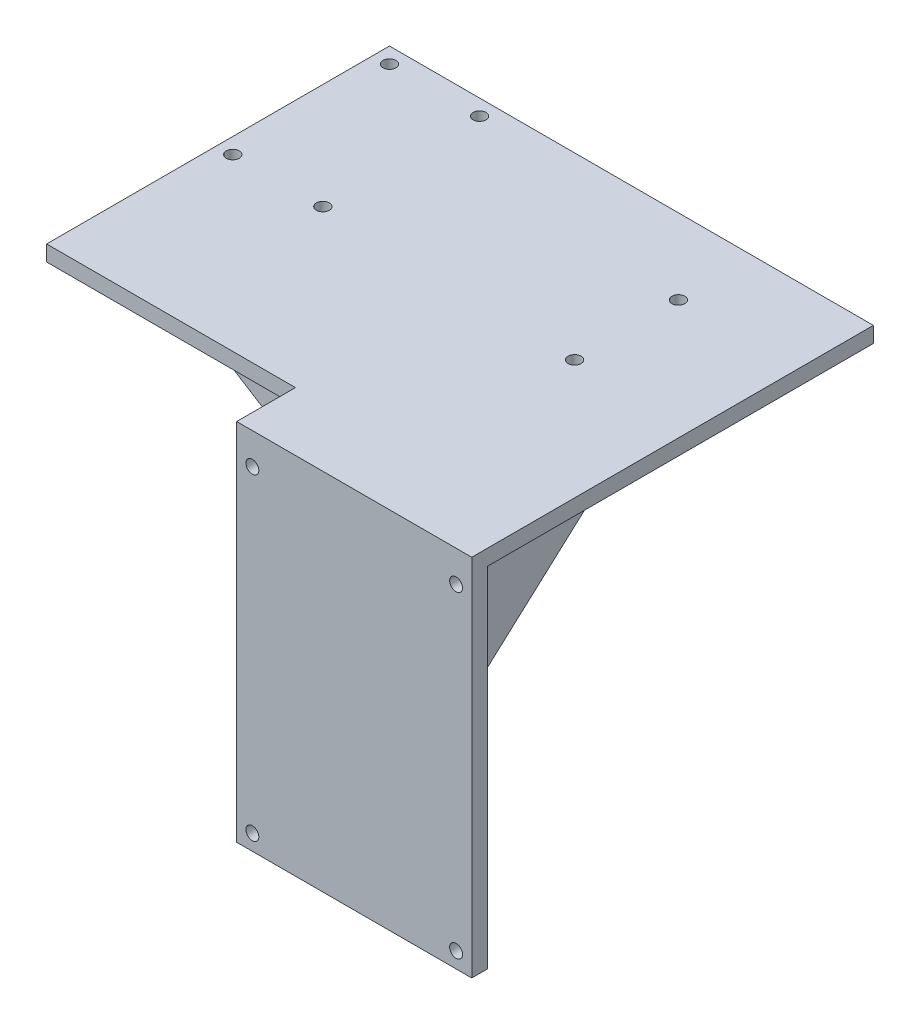
from build123d import *

# Parameters (mm, degrees)
SKETCH1_W           = 60
SKETCH1_H           = 93
BOSS_EXTRUDE1_DEPTH = 4
SKETCH3_R           = 1.65
CUT_EXTRUDE1_DEPTH  = 4
SKETCH5_W           = 60
SKETCH5_H           = 4
BOSS_EXTRUDE2_DEPTH = 11
SKETCH6_W           = 123.5
SKETCH6_H           = 4
BOSS_EXTRUDE3_DEPTH = 87.5
SKETCH7_R           = 1.65
CUT_EXTRUDE2_DEPTH  = 87.5
SKETCH10_R          = 1.65
CUT_EXTRUDE3_DEPTH  = 10
SKETCH11_W          = 98.5
SKETCH11_H          = 89
BOSS_EXTRUDE4_DEPTH = 25
SKETCH13_W          = 98.5
SKETCH13_H          = 89
CUT_EXTRUDE5_DEPTH  = 8
CUT_EXTRUDE7_DEPTH  = 20
SKETCH15_W          = 71.5
SKETCH15_H          = 17
BOSS_EXTRUDE6_DEPTH = 45
CUT_EXTRUDE9_DEPTH  = 45


with BuildPart() as part:
    # Sketch1 → Boss-Extrude1 (new body)
    with BuildSketch(Plane.XY):
        with Locations((30, -46.5)):
            Rectangle(SKETCH1_W, SKETCH1_H)
    extrude(amount=-BOSS_EXTRUDE1_DEPTH)

    # Sketch3 → Cut-Extrude1 (cut)
    with BuildSketch(Plane.XY):
        with Locations((4, -8)):
            Circle(SKETCH3_R)
        with Locations((56, -8)):
            Circle(SKETCH3_R)
        with Locations((4, -89)):
            Circle(SKETCH3_R)
        with Locations((56, -89)):
            Circle(SKETCH3_R)
    extrude(amount=-CUT_EXTRUDE1_DEPTH, mode=Mode.SUBTRACT)

    # Sketch5 → Boss-Extrude2 (add)
    with BuildSketch(Plane(origin=(0, 0, -4), x_dir=(-1, 0, 0), z_dir=(0, 0, -1))):
        with Locations((-30, -2)):
            Rectangle(SKETCH5_W, SKETCH5_H)
    extrude(amount=BOSS_EXTRUDE2_DEPTH)

    # Sketch6 → Boss-Extrude3 (add)
    with BuildSketch(Plane(origin=(0, 0, -15), x_dir=(-1, 0, 0), z_dir=(0, 0, -1))):
        with Locations((1.75, -2)):
            Rectangle(SKETCH6_W, SKETCH6_H)
    extrude(amount=BOSS_EXTRUDE3_DEPTH)

    # Sketch7 → Cut-Extrude2 (cut)
    with BuildSketch(Plane(origin=(0, 0, 0), x_dir=(1, 0, 0), z_dir=(0, 1, 0))):
        with Locations(Location((-59.5, 98.5, 0), (0, 0, 270))):
            Circle(SKETCH7_R)
        with Locations(Location((-36.5, 98.5, 0), (0, 0, 270))):
            Circle(SKETCH7_R)
        with Locations(Location((-59.5, 58.5, 0), (0, 0, 270))):
            Circle(SKETCH7_R)
        with Locations(Location((-36.5, 58.5, 0), (0, 0, 270))):
            Circle(SKETCH7_R)
    extrude(amount=-CUT_EXTRUDE2_DEPTH, mode=Mode.SUBTRACT)

    # Sketch10 → Cut-Extrude3 (cut)
    with BuildSketch(Plane(origin=(0, 0, 0), x_dir=(1, 0, 0), z_dir=(0, 1, 0))):
        with Locations(Location((29.5, 83.25, 0), (0, 0, 270))):
            Circle(SKETCH10_R)
        with Locations(Location((29.5, 56.75, 0), (0, 0, 270))):
            Circle(SKETCH10_R)
    extrude(amount=-CUT_EXTRUDE3_DEPTH, mode=Mode.SUBTRACT)

    # Sketch11 → Boss-Extrude4 (add)
    with BuildSketch(Plane(origin=(0, 0, 0), x_dir=(0, 0, -1), z_dir=(1, 0, 0))):
        with Locations((53.25, -48.5)):
            Rectangle(SKETCH11_W, SKETCH11_H)
    extrude(amount=BOSS_EXTRUDE4_DEPTH)

    # Sketch13 → Cut-Extrude5 (cut)
    with BuildSketch(Plane.ZY):
        with Locations((-53.25, -48.5)):
            Rectangle(SKETCH13_W, SKETCH13_H)
    extrude(amount=-CUT_EXTRUDE5_DEPTH, mode=Mode.SUBTRACT)

    # Sketch14 → Cut-Extrude7 (cut)
    with BuildSketch(Plane.ZY.offset(-8)):
        Polygon((-102.5, -4), (-102.5, -93), (-4, -93), align=None)
    extrude(amount=-CUT_EXTRUDE7_DEPTH, mode=Mode.SUBTRACT)

    # Sketch15 → Boss-Extrude6 (add)
    with BuildSketch(Plane.XZ.offset(4)):
        with Locations((-27.75, -42)):
            Rectangle(SKETCH15_W, SKETCH15_H)
    extrude(amount=BOSS_EXTRUDE6_DEPTH)

    # Sketch16 → Cut-Extrude9 (cut)
    with BuildSketch(Plane(origin=(0, 0, -50.5), x_dir=(-1, 0, 0), z_dir=(0, 0, -1))):
        Polygon((63.5, -4), (-8, -49), (63.5, -49), align=None)
    extrude(amount=-CUT_EXTRUDE9_DEPTH, mode=Mode.SUBTRACT)


solid = part.part
